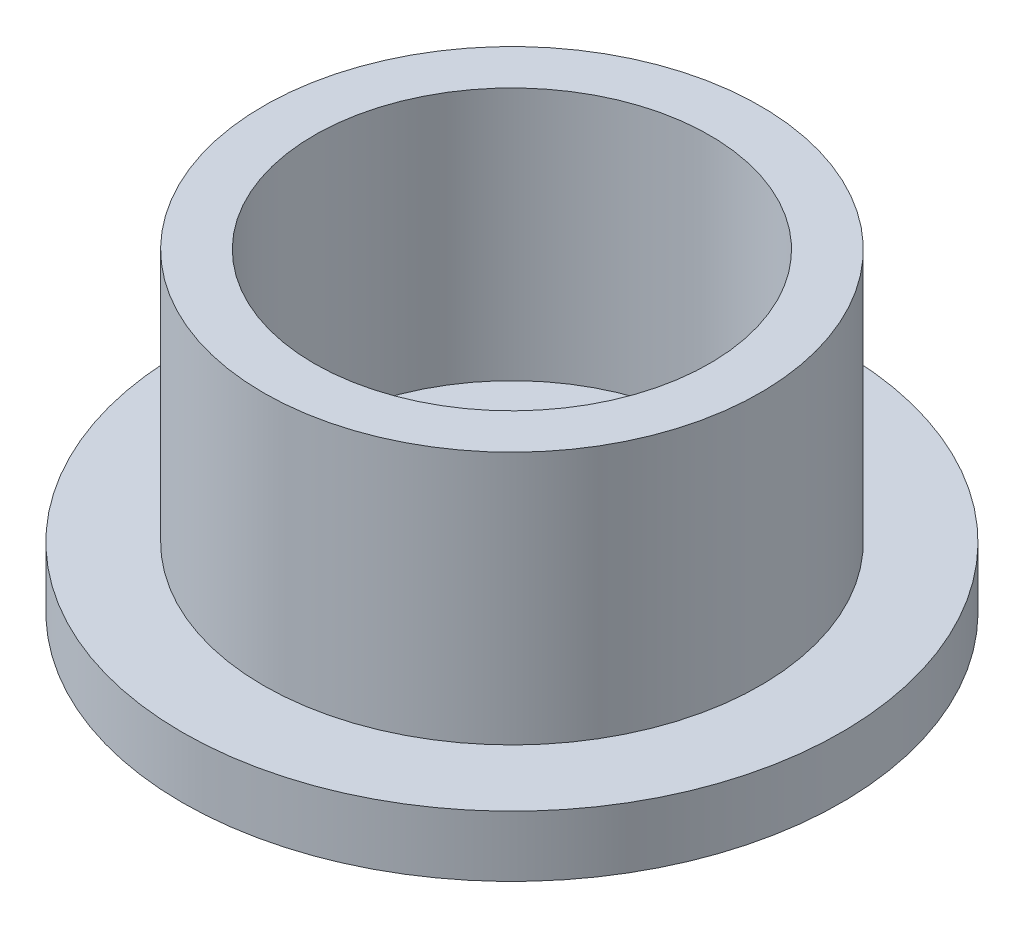
from build123d import *

# Parameters (mm, degrees)
SKETCH1_R           = 6.5
BOSS_EXTRUDE1_DEPTH = 1.2
SKETCH2_R           = 4.9
SKETCH2_R_2         = 3.9
BOSS_EXTRUDE2_DEPTH = 5


with BuildPart() as part:
    # Sketch1 → Boss-Extrude1 (new body)
    with BuildSketch(Plane(origin=(0, 0, 0), x_dir=(1, 0, 0), z_dir=(0, 1, 0))):
        with Locations(Location((0, 0, 0), (0, 0, 270))):
            Circle(SKETCH1_R)
    extrude(amount=BOSS_EXTRUDE1_DEPTH)

    # Sketch2 → Boss-Extrude2 (add)
    with BuildSketch(Plane(origin=(0, 1.2, 0), x_dir=(1, 0, 0), z_dir=(0, 1, 0))):
        with Locations(Location((0, 0, 0), (0, 0, 270))):
            Circle(SKETCH2_R)
        with Locations(Location((0, 0, 0), (0, 0, 270))):
            Circle(SKETCH2_R_2, mode=Mode.SUBTRACT)
    extrude(amount=BOSS_EXTRUDE2_DEPTH)


solid = part.part
